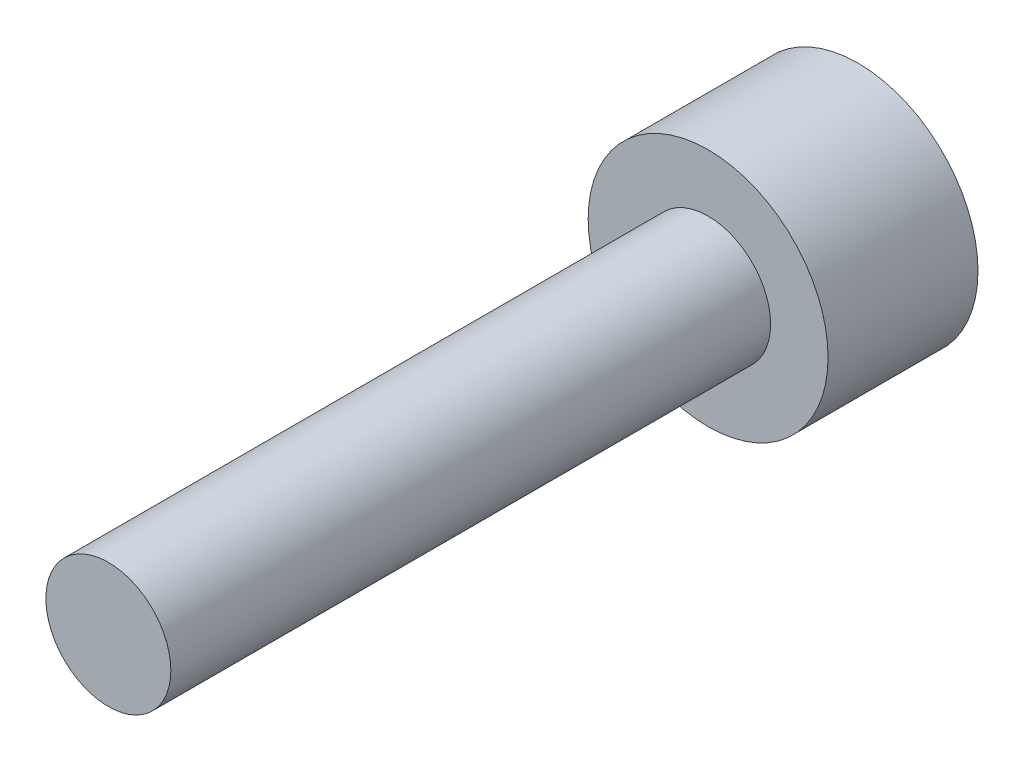
from build123d import *

# Parameters (mm, degrees)
SKETCH1_R               = 7.62
TOP_HEAD_DEPTH          = 9.525
LOWER_START             = 6.35
SKETCH1_4_R             = 3.96875
LOWER_PIN_DEPTH         = 41.275
SKETCH2_R               = 3.175
O_RING_OPENING_DEPTH    = 4.7625
SKETCH2_3_R             = 1.5875
POT_SHAFT_OPENING_DEPTH = 13.589


with BuildPart() as part:
    # Sketch1 → Top Head (new body)
    with BuildSketch(Plane.XY):
        Circle(SKETCH1_R)
    extrude(amount=TOP_HEAD_DEPTH)

    # Sketch1<4> → Lower Pin (add)
    with BuildSketch(Plane.XY.offset(LOWER_START)):
        Circle(SKETCH1_4_R)
    extrude(amount=LOWER_PIN_DEPTH)

    # Sketch2 → O-Ring Opening (cut)
    with BuildSketch(Plane(origin=(0, 0, 0), x_dir=(-1, 0, 0), z_dir=(0, 0, -1))):
        Circle(SKETCH2_R)
    extrude(amount=-O_RING_OPENING_DEPTH, mode=Mode.SUBTRACT)

    # Sketch2<3> → POT Shaft Opening (cut)
    with BuildSketch(Plane(origin=(0, 0, 0), x_dir=(-1, 0, 0), z_dir=(0, 0, -1))):
        Circle(SKETCH2_3_R)
    extrude(amount=-POT_SHAFT_OPENING_DEPTH, mode=Mode.SUBTRACT)


solid = part.part
